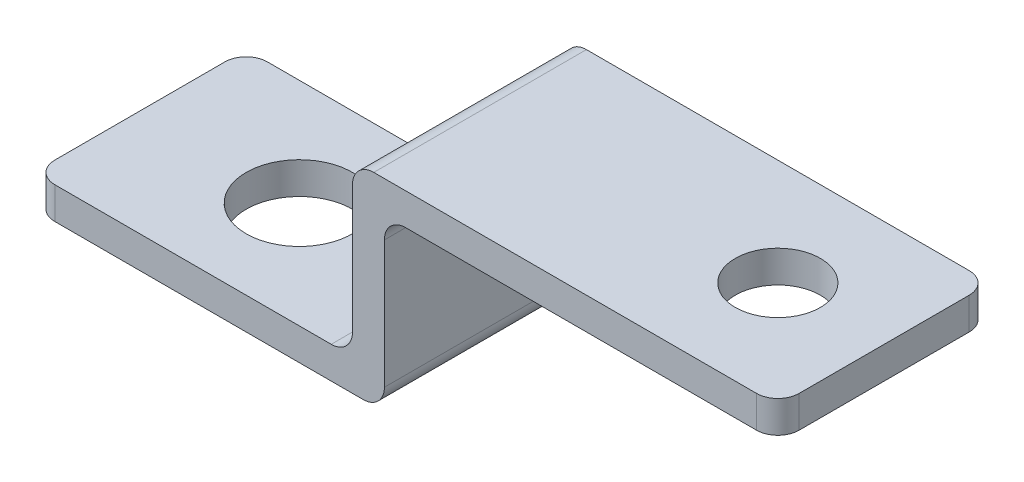
from build123d import *

# Parameters (mm, degrees)
EXTRUDE_THIN1_DEPTH = 10
SKETCH2_R           = 2
SKETCH2_R_2         = 2.5
CUT_EXTRUDE1_DEPTH  = 38.619808612
FILLET2_R           = 1


with BuildPart() as part:
    # Sketch1 → Extrude-Thin1 (new body)
    with BuildSketch(Plane.XY):
        Polygon((0, 0), (15, 0), (15, 8), (35, 8), (35, 6.5), (16.5, 6.5), (16.5, -1.5), (0, -1.5), align=None)
    extrude(amount=EXTRUDE_THIN1_DEPTH)

    # Sketch2 → Cut-Extrude1 (cut, through all)
    with BuildSketch(Plane(origin=(0, 8, 0), x_dir=(1, 0, 0), z_dir=(0, 1, 0))):
        with Locations(Location((30, -5, 0), (0, 0, 270))):
            Circle(SKETCH2_R)
        with Locations(Location((7.5, -5, 0), (0, 0, 270))):
            Circle(SKETCH2_R_2)
    extrude(amount=-CUT_EXTRUDE1_DEPTH, mode=Mode.SUBTRACT)

    # Fillet2
    fillet2_edges = [part.edges().sort_by_distance(p)[0] for p in [
        (16.5, 6.5, 5),
        (16.5, -1.5, 5),
        (15, 0, 5),
        (15, 8, 5),
        (0, -0.75, 10),
        (0, -0.75, 0),
        (35, 7.25, 10),
        (35, 7.25, 0),
    ]]
    fillet(fillet2_edges, radius=FILLET2_R)


solid = part.part
